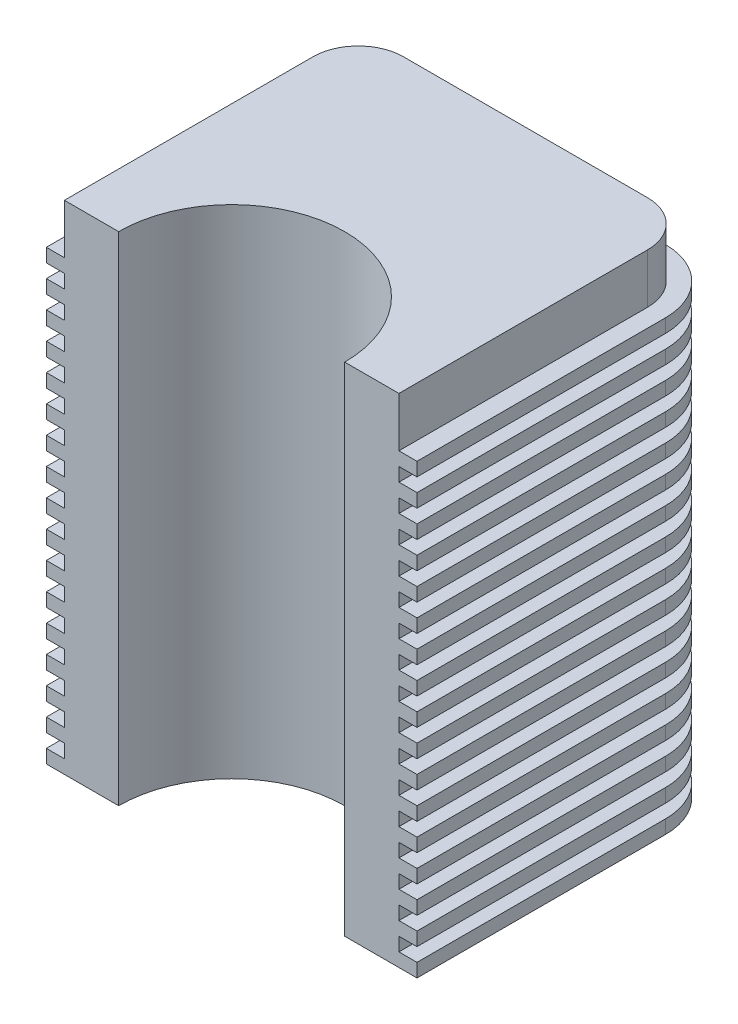
from build123d import *

# Parameters (mm, degrees)
BOSS_EXTRUDE1_DEPTH = 110
BOSS_EXTRUDE2_DEPTH = 3
LPATTERN1_COUNT     = 17
LPATTERN1_PITCH     = 6
CUT_EXTRUDE1_DEPTH  = 100


with BuildPart() as part:
    # Sketch2 → Boss-Extrude1 (new body)
    with BuildSketch(Plane(origin=(0, 0, 0), x_dir=(1, 0, 0), z_dir=(0, 1, 0))):
        with BuildLine():
            Line((25, 0), (37, 0))
            Line((37, 0), (37, 55))
            ThreePointArc((37, 55), (34.071067812, 62.071067812), (27, 65))
            Line((27, 65), (-27, 65))
            ThreePointArc((-27, 65), (-34.071067812, 62.071067812), (-37, 55))
            Line((-37, 55), (-37, 0))
            Line((-37, 0), (-25, 0))
            ThreePointArc((-25, 0), (0, 25), (25, 0))
        make_face()
    extrude(amount=BOSS_EXTRUDE1_DEPTH)

    # Sketch4 → Boss-Extrude2 (add)
    with BuildSketch(Plane.XZ):
        with BuildLine():
            Line((-41, 0), (-41, -55))
            ThreePointArc((-41, -55), (-36.899494937, -64.899494937), (-27, -69))
            Line((-27, -69), (27, -69))
            ThreePointArc((27, -69), (36.899494937, -64.899494937), (41, -55))
            Line((41, -55), (41, 0))
            Line((41, 0), (37, 0))
            Line((37, 0), (37, -55))
            ThreePointArc((37, -55), (34.071067812, -62.071067812), (27, -65))
            Line((27, -65), (-27, -65))
            ThreePointArc((-27, -65), (-34.071067812, -62.071067812), (-37, -55))
            Line((-37, -55), (-37, 0))
            Line((-37, 0), (-41, 0))
        make_face()
    boss_extrude2 = extrude(amount=-BOSS_EXTRUDE2_DEPTH)

    # LPattern1: Boss-Extrude2 ×17
    with Locations(*[(0, i * LPATTERN1_PITCH, 0) for i in range(1, LPATTERN1_COUNT)]):
        add(boss_extrude2)

    # Sketch5 → Cut-Extrude1 (cut)
    with BuildSketch(Plane.XZ):
        with BuildLine():
            Line((-31.224989992, -7), (-34, -7))
            Line((-34, -7), (-34, -55))
            ThreePointArc((-34, -55), (-31.949747468, -59.949747468), (-27, -62))
            Line((-27, -62), (27, -62))
            ThreePointArc((27, -62), (31.949747468, -59.949747468), (34, -55))
            Line((34, -55), (34, -7))
            Line((34, -7), (31.224989992, -7))
            ThreePointArc((31.224989992, -7), (0, -32), (-31.224989992, -7))
        make_face()
    extrude(amount=-CUT_EXTRUDE1_DEPTH, mode=Mode.SUBTRACT)


solid = part.part
